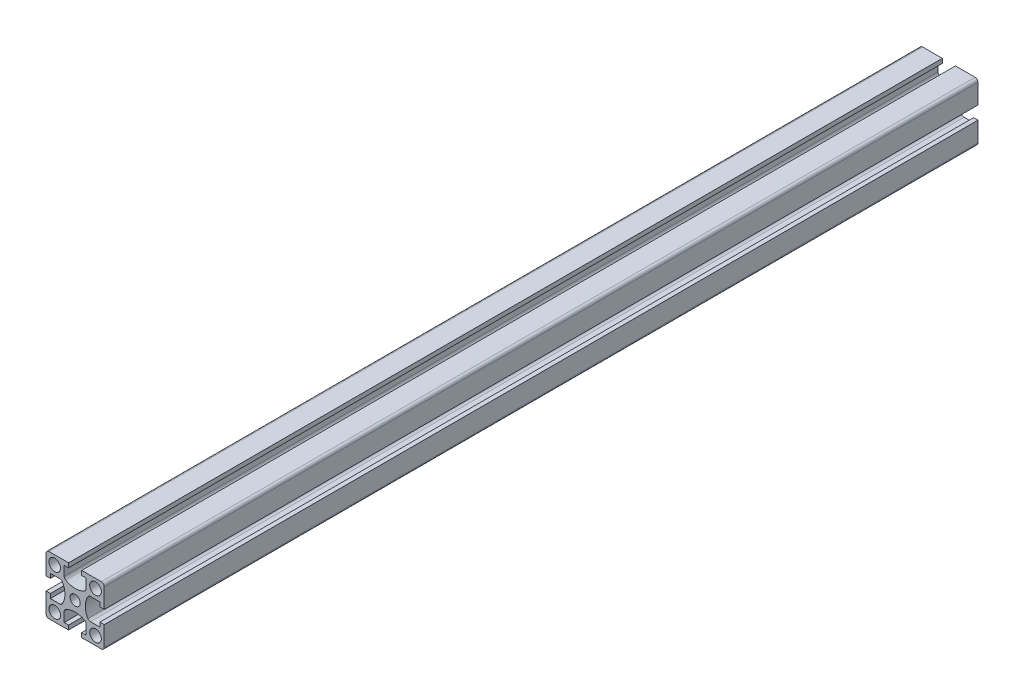
from build123d import *

# Parameters (mm, degrees)
SKETCH1_R           = 2
SKETCH1_R_2         = 1.75
BOSS_EXTRUDE1_DEPTH = 300


with BuildPart() as part:
    # Sketch1 → Boss-Extrude1 (new body)
    with BuildSketch(Plane.XY):
        with BuildLine():
            Line((-10, 9), (-10, 2.25))
            Line((-10, 2.25), (-8.5, 2.25))
            Line((-8.5, 2.25), (-8.5, 3.75))
            Line((-8.5, 3.75), (-5.236860279, 3.75))
            ThreePointArc((-5.236860279, 3.75), (-4.736860279, 3.616025404), (-4.370834875, 3.25))
            ThreePointArc((-4.370834875, 3.25), (-3.5, 0), (-4.370834875, -3.25))
            ThreePointArc((-4.370834875, -3.25), (-4.736860279, -3.616025404), (-5.236860279, -3.75))
            Line((-5.236860279, -3.75), (-8.5, -3.75))
            Line((-8.5, -3.75), (-8.5, -2.25))
            Line((-8.5, -2.25), (-10, -2.25))
            Line((-10, -2.25), (-10, -9))
            ThreePointArc((-10, -9), (-9.707106781, -9.707106781), (-9, -10))
            Line((-9, -10), (-2.25, -10))
            Line((-2.25, -10), (-2.25, -8.5))
            Line((-2.25, -8.5), (-3.75, -8.5))
            Line((-3.75, -8.5), (-3.75, -5.236860279))
            ThreePointArc((-3.75, -5.236860279), (-3.616025404, -4.736860279), (-3.25, -4.370834875))
            ThreePointArc((-3.25, -4.370834875), (0, -3.5), (3.25, -4.370834875))
            ThreePointArc((3.25, -4.370834875), (3.616025404, -4.736860279), (3.75, -5.236860279))
            Line((3.75, -5.236860279), (3.75, -8.5))
            Line((3.75, -8.5), (2.25, -8.5))
            Line((2.25, -8.5), (2.25, -10))
            Line((2.25, -10), (9, -10))
            ThreePointArc((9, -10), (9.707106781, -9.707106781), (10, -9))
            Line((10, -9), (10, -2.25))
            Line((10, -2.25), (8.5, -2.25))
            Line((8.5, -2.25), (8.5, -3.75))
            Line((8.5, -3.75), (5.236860279, -3.75))
            ThreePointArc((5.236860279, -3.75), (4.736860279, -3.616025404), (4.370834875, -3.25))
            ThreePointArc((4.370834875, -3.25), (3.5, 0), (4.370834875, 3.25))
            ThreePointArc((4.370834875, 3.25), (4.736860279, 3.616025404), (5.236860279, 3.75))
            Line((5.236860279, 3.75), (8.5, 3.75))
            Line((8.5, 3.75), (8.5, 2.25))
            Line((8.5, 2.25), (10, 2.25))
            Line((10, 2.25), (10, 9))
            ThreePointArc((10, 9), (9.707106781, 9.707106781), (9, 10))
            Line((9, 10), (2.25, 10))
            Line((2.25, 10), (2.25, 8.5))
            Line((2.25, 8.5), (3.75, 8.5))
            Line((3.75, 8.5), (3.75, 5.236860279))
            ThreePointArc((3.75, 5.236860279), (3.616025404, 4.736860279), (3.25, 4.370834875))
            ThreePointArc((3.25, 4.370834875), (0, 3.5), (-3.25, 4.370834875))
            ThreePointArc((-3.25, 4.370834875), (-3.616025404, 4.736860279), (-3.75, 5.236860279))
            Line((-3.75, 5.236860279), (-3.75, 8.5))
            Line((-3.75, 8.5), (-2.25, 8.5))
            Line((-2.25, 8.5), (-2.25, 10))
            Line((-2.25, 10), (-9, 10))
            ThreePointArc((-9, 10), (-9.707106781, 9.707106781), (-10, 9))
        make_face()
        with Locations((-7, -7)):
            Circle(SKETCH1_R, mode=Mode.SUBTRACT)
        with Locations((7, -7)):
            Circle(SKETCH1_R, mode=Mode.SUBTRACT)
        with Locations((7, 7)):
            Circle(SKETCH1_R, mode=Mode.SUBTRACT)
        Circle(SKETCH1_R_2, mode=Mode.SUBTRACT)
        with Locations((-7, 7)):
            Circle(SKETCH1_R, mode=Mode.SUBTRACT)
    extrude(amount=BOSS_EXTRUDE1_DEPTH)


solid = part.part
